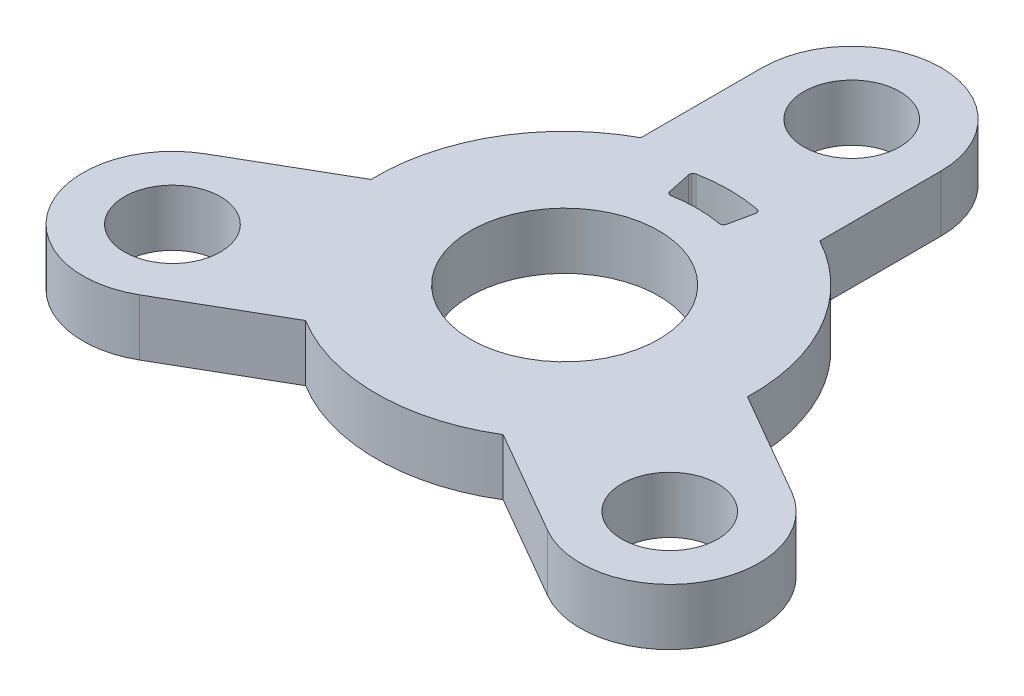
from build123d import *

# Parameters (mm, degrees)
SKETCH1_R           = 10
SKETCH1_R_2         = 5
BOSS_EXTRUDE1_DEPTH = 3
BOSS_EXTRUDE2_START = -3
SKETCH2_R           = 2.55
BOSS_EXTRUDE2_DEPTH = 3
CIRPATTERN1_COUNT   = 3
CUT_EXTRUDE1_DEPTH  = 28.045328716
FILLET1_R           = 0.2


with BuildPart() as part:
    # Sketch1 → Boss-Extrude1 (new body)
    with BuildSketch(Plane(origin=(0, 0, 0), x_dir=(1, 0, 0), z_dir=(0, 1, 0))):
        with Locations(Location((0, 0, 0), (0, 0, 270))):
            Circle(SKETCH1_R)
        with Locations(Location((0, 0, 0), (0, 0, 270))):
            Circle(SKETCH1_R_2, mode=Mode.SUBTRACT)
    extrude(amount=BOSS_EXTRUDE1_DEPTH)

    # Sketch2 → Boss-Extrude2 (add)
    with BuildSketch(Plane(origin=(0, 3, 0), x_dir=(1, 0, 0), z_dir=(0, 1, 0)).offset(BOSS_EXTRUDE2_START)):
        with BuildLine():
            Line((-4.75, 15.25), (-4.75, 8.799857953))
            ThreePointArc((-4.75, 8.799857953), (0, 10), (4.75, 8.799857953))
            Line((4.75, 8.799857953), (4.75, 15.25))
            ThreePointArc((4.75, 15.25), (0, 20), (-4.75, 15.25))
        make_face()
        with Locations(Location((0, 15.25, 0), (0, 0, 270))):
            Circle(SKETCH2_R, mode=Mode.SUBTRACT)
    boss_extrude2 = extrude(amount=BOSS_EXTRUDE2_DEPTH)

    # CirPattern1: Boss-Extrude2 ×3 about axis
    cirpattern1_axis = Axis((0, 0, 0), (0, 1, 0))
    for i in range(1, CIRPATTERN1_COUNT):
        add(boss_extrude2.rotate(cirpattern1_axis, i * 360 / CIRPATTERN1_COUNT))

    # Sketch3 → Cut-Extrude1 (cut, through all)
    with BuildSketch(Plane(origin=(0, 3, 0), x_dir=(1, 0, 0), z_dir=(0, 1, 0))):
        with BuildLine():
            Line((-1.819227295, 8.558791506), (-1.46577742, 6.895940585))
            ThreePointArc((-1.46577742, 6.895940585), (0, 7.05), (1.46577742, 6.895940585))
            Line((1.46577742, 6.895940585), (1.819227295, 8.558791506))
            ThreePointArc((1.819227295, 8.558791506), (0, 8.75), (-1.819227295, 8.558791506))
        make_face()
    extrude(amount=-CUT_EXTRUDE1_DEPTH, mode=Mode.SUBTRACT)

    # Fillet1
    fillet1_edges = [part.edges().sort_by_distance(p)[0] for p in [
        (1.46577742, 1.5, -6.895940585),
        (-1.46577742, 1.5, -6.895940585),
        (-1.819227295, 1.5, -8.558791506),
        (1.819227295, 1.5, -8.558791506),
    ]]
    fillet(fillet1_edges, radius=FILLET1_R)


solid = part.part
